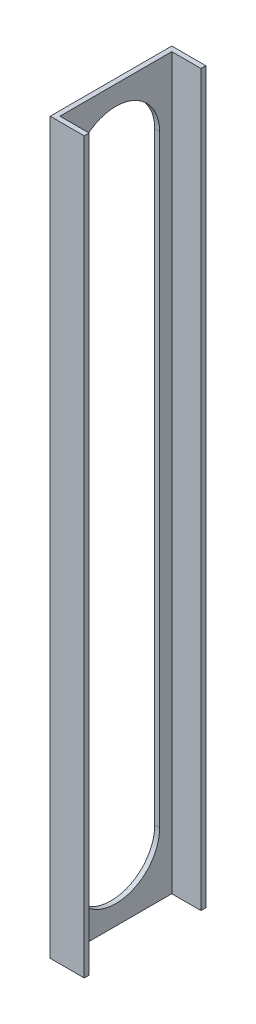
from build123d import *

# Parameters (mm, degrees)
EXTRUDE_1_DEPTH     = 300
CUT_EXTRUDE_1_DEPTH = 305.46017802


with BuildPart() as part:
    # 草图1 → 凸台-拉伸1 (new body)
    with BuildSketch(Plane(origin=(0, 0, 0), x_dir=(1, 0, 0), z_dir=(0, 1, 0))):
        Polygon((0, 0), (0, 50), (14, 50), (14, 48), (2, 48), (2, 2), (14, 2), (14, 0), align=None)
    extrude(amount=EXTRUDE_1_DEPTH)

    # 草图2 → 切除-拉伸1 (cut, through all)
    with BuildSketch(Plane.ZY):
        with BuildLine():
            Line((-7, 274), (-7, 26))
            ThreePointArc((-7, 26), (-25, 8), (-43, 26))
            Line((-43, 26), (-43, 274))
            ThreePointArc((-43, 274), (-25, 292), (-7, 274))
        make_face()
    extrude(amount=-CUT_EXTRUDE_1_DEPTH, mode=Mode.SUBTRACT)


solid = part.part
